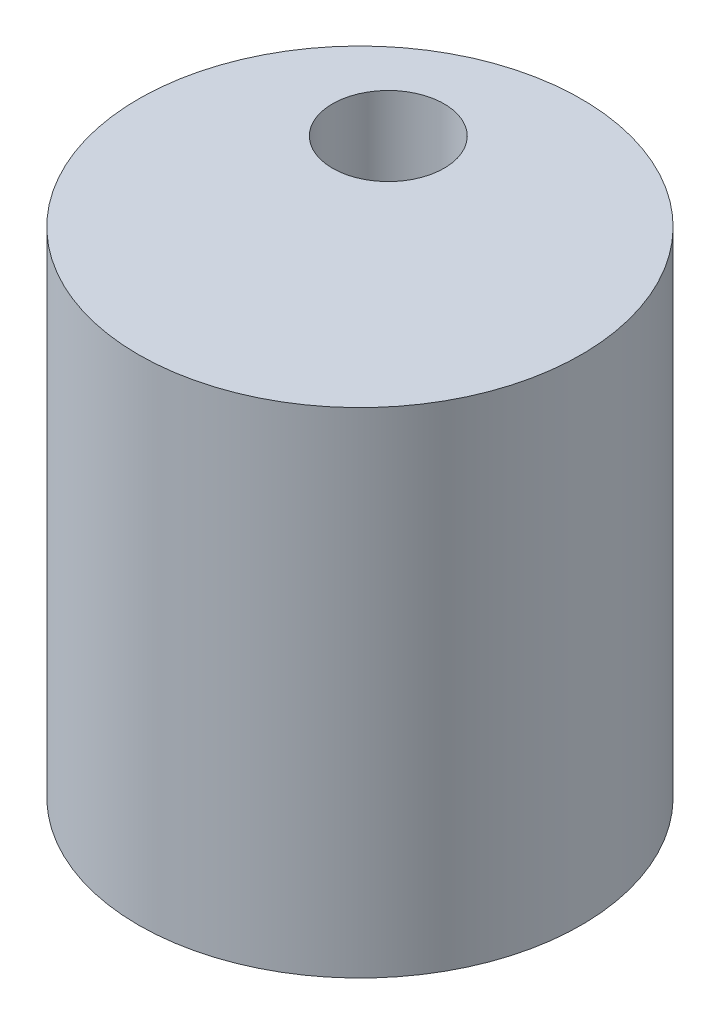
from build123d import *

# Parameters (mm, degrees)
SKETCH1_R           = 13.0937
SKETCH1_R_2         = 3.302
BOSS_EXTRUDE1_DEPTH = 29.21


with BuildPart() as part:
    # Sketch1 → Boss-Extrude1 (new body)
    with BuildSketch(Plane(origin=(0, 0, 0), x_dir=(1, 0, 0), z_dir=(0, 1, 0))):
        with Locations(Location((0, 0, 0), (0, 0, 270))):
            Circle(SKETCH1_R)
        with Locations(Location((-3.81, 5.4864, 0), (0, 0, 270))):
            Circle(SKETCH1_R_2, mode=Mode.SUBTRACT)
    extrude(amount=-BOSS_EXTRUDE1_DEPTH)


solid = part.part
